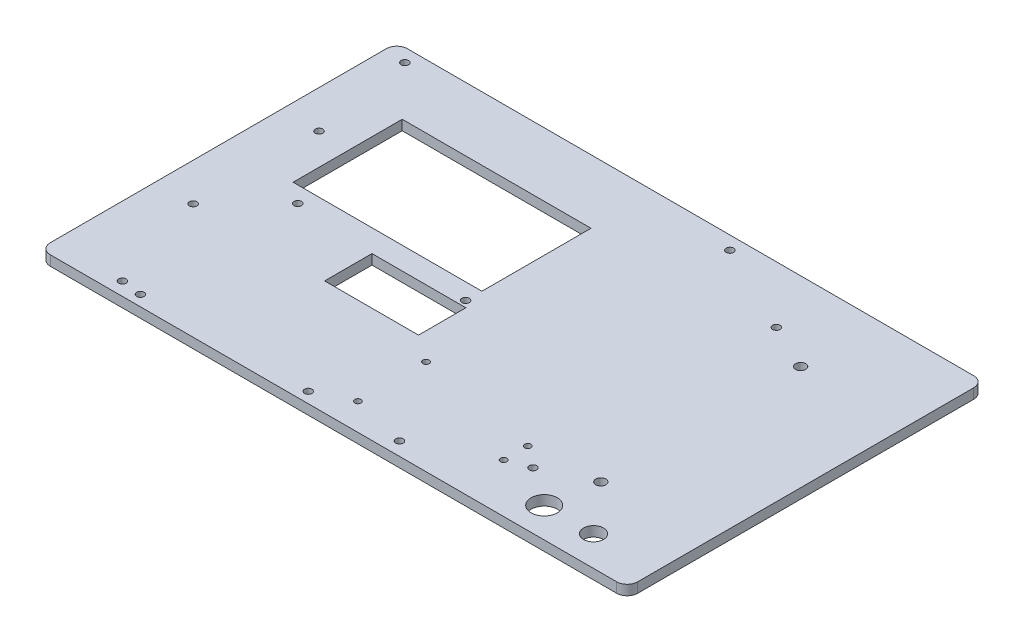
from build123d import *

# Parameters (mm, degrees)
BOSS_EXTRUDE1_DEPTH          = 4.7625
SKETCH2_R                    = 1.778
CHASSIS_STANDOFF_DEPTH       = 164.899327351
SKETCH3_R                    = 1.5
VESC_DEPTH                   = 164.899327351
SKETCH13_R                   = 1.778
SKETCH13_W                   = 44.755773095
SKETCH13_H                   = 22.569704292
PCB_DEPTH                    = 164.899327351
SKETCH6_W                    = 90
SKETCH6_H                    = 52
JETSON_DEPTH                 = 164.899327351
SKETCH12_R                   = 1.778
TOP_PLATE_STANDOFF_DEPTH     = 164.899327351
SKETCH14_R                   = 2.413
VELODYNE_INTERFACE_BOX_DEPTH = 164.899327351
SKETCH16_R                   = 6.25
SKETCH16_R_2                 = 4.7625
SWITCH_DEPTH                 = 164.899327351


with BuildPart() as part:
    # Sketch1 → Boss-Extrude1 (new body)
    with BuildSketch(Plane(origin=(0, 0, 0), x_dir=(1, 0, 0), z_dir=(0, 1, 0))):
        with BuildLine():
            Line((-135, 85.09), (135, 85.09))
            ThreePointArc((135, 85.09), (138.535533906, 83.625533906), (140, 80.09))
            Line((140, 80.09), (140, -80.09))
            ThreePointArc((140, -80.09), (138.535533906, -83.625533906), (135, -85.09))
            Line((135, -85.09), (-135, -85.09))
            ThreePointArc((-135, -85.09), (-138.535533906, -83.625533906), (-140, -80.09))
            Line((-140, -80.09), (-140, 80.09))
            ThreePointArc((-140, 80.09), (-138.535533906, 83.625533906), (-135, 85.09))
        make_face()
    extrude(amount=BOSS_EXTRUDE1_DEPTH)

    # Sketch2 → chassis standoff (cut, through all)
    with BuildSketch(Plane(origin=(0, 0, 0), x_dir=(1, 0, 0), z_dir=(0, 1, 0))):
        with Locations(Location((68, 58, 0), (0, 0, 90))):
            Circle(SKETCH2_R)
        with Locations(Location((68, -58, 0), (0, 0, 90))):
            Circle(SKETCH2_R)
        with Locations(Location((-122, 30, 0), (0, 0, 90))):
            Circle(SKETCH2_R)
        with Locations(Location((-122, -30, 0), (0, 0, 90))):
            Circle(SKETCH2_R)
    extrude(amount=CHASSIS_STANDOFF_DEPTH, mode=Mode.SUBTRACT)

    # Sketch3 → vesc (cut, through all)
    with BuildSketch(Plane(origin=(0, 0, 0), x_dir=(1, 0, 0), z_dir=(0, 1, 0))):
        with Locations(Location((57.771213393, -50.24032748, 0), (0, 0, 90))):
            Circle(SKETCH3_R)
        with Locations(Location((57.771213393, -61.74032748, 0), (0, 0, 90))):
            Circle(SKETCH3_R)
        with Locations(Location((-1.228786607, -39.74032748, 0), (0, 0, 90))):
            Circle(SKETCH3_R)
        with Locations(Location((-1.228786607, -72.24032748, 0), (0, 0, 90))):
            Circle(SKETCH3_R)
    extrude(amount=VESC_DEPTH, mode=Mode.SUBTRACT)

    # Sketch13 → pcb (cut, through all)
    with BuildSketch(Plane(origin=(0, 0, 0), x_dir=(1, 0, 0), z_dir=(0, 1, 0))):
        with Locations(Location((-97.170021332, -4.946954695, 0), (0, 0, 90))):
            Circle(SKETCH13_R)
        with Locations(Location((-17.170021332, -4.946954695, 0), (0, 0, 90))):
            Circle(SKETCH13_R)
        with Locations(Location((-17.170021332, -79.946954695, 0), (0, 0, 90))):
            Circle(SKETCH13_R)
        with Locations(Location((-97.170021332, -79.946954695, 0), (0, 0, 90))):
            Circle(SKETCH13_R)
        with Locations((-36.456414677, -19.201465216)):
            Rectangle(SKETCH13_W, SKETCH13_H)
    extrude(amount=PCB_DEPTH, mode=Mode.SUBTRACT)

    # Sketch6 → jetson (cut, through all)
    with BuildSketch(Plane(origin=(0, 0, 0), x_dir=(1, 0, 0), z_dir=(0, 1, 0))):
        with Locations((-62.08, 28.74)):
            Rectangle(SKETCH6_W, SKETCH6_H)
    extrude(amount=JETSON_DEPTH, mode=Mode.SUBTRACT)

    # Sketch12 → top plate standoff (cut, through all)
    with BuildSketch(Plane(origin=(0, 0, 0), x_dir=(1, 0, 0), z_dir=(0, 1, 0))):
        with Locations(Location((-129.82, 78.74, 0), (0, 0, 90))):
            Circle(SKETCH12_R)
        with Locations(Location((-106.98, -78.74, 0), (0, 0, 90))):
            Circle(SKETCH12_R)
        with Locations(Location((25.1, 78.74, 0), (0, 0, 90))):
            Circle(SKETCH12_R)
        with Locations(Location((25.1, -78.74, 0), (0, 0, 90))):
            Circle(SKETCH12_R)
    extrude(amount=TOP_PLATE_STANDOFF_DEPTH, mode=Mode.SUBTRACT)

    # Sketch14 → velodyne interface box (cut, through all)
    with BuildSketch(Plane(origin=(0, 0, 0), x_dir=(1, 0, 0), z_dir=(0, 1, 0))):
        with Locations(Location((89.981111903, 47.625, 0), (0, 0, 90))):
            Circle(SKETCH14_R)
        with Locations(Location((89.981111903, -47.625, 0), (0, 0, 90))):
            Circle(SKETCH14_R)
    extrude(amount=VELODYNE_INTERFACE_BOX_DEPTH, mode=Mode.SUBTRACT)

    # Sketch16 → switch (cut, through all)
    with BuildSketch(Plane(origin=(0, 0, 0), x_dir=(1, 0, 0), z_dir=(0, 1, 0))):
        with Locations(Location((86.14110244, -70.782450254, 0), (0, 0, 90))):
            Circle(SKETCH16_R)
        with Locations(Location((109.644443051, -70.782450254, 0), (0, 0, 90))):
            Circle(SKETCH16_R_2)
    extrude(amount=SWITCH_DEPTH, mode=Mode.SUBTRACT)


solid = part.part
